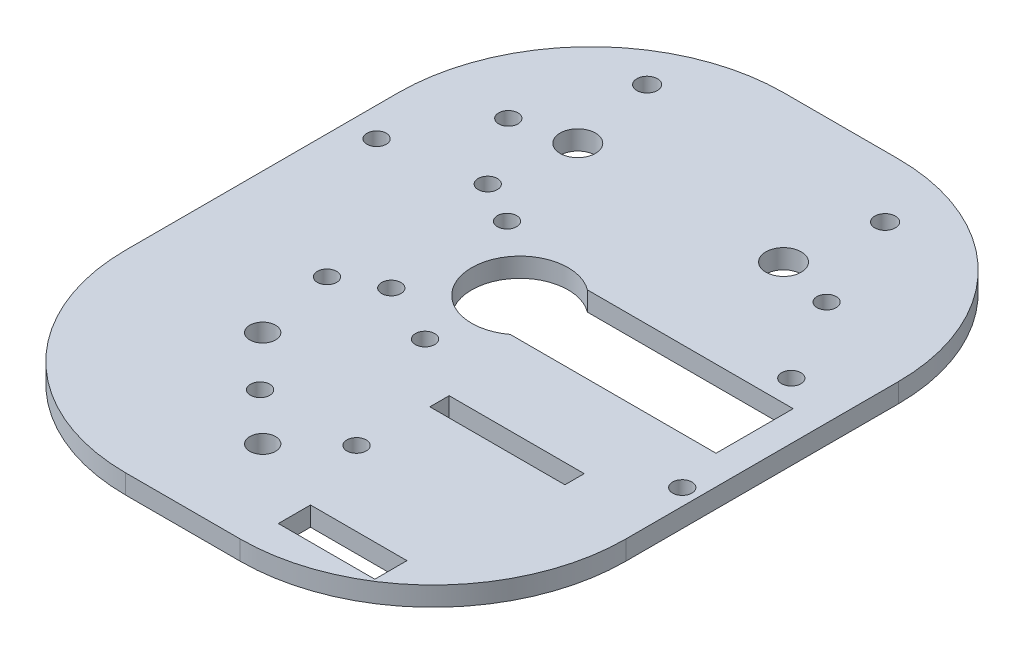
from build123d import *

# Parameters (mm, degrees)
SKETCH1_W               = 77.793311879
SKETCH1_H               = 102.364407774
SKETCH1_R               = 2.75
SKETCH1_R_2             = 2
SKETCH1_R_3             = 7.5
BOSS_EXTRUDE1_DEPTH     = 3
CUT_EXTRUDE1_DEPTH      = 69.323346558
CUT_EXTRUDE1_DEPTH_BACK = 69.323346558
SKETCH2_R               = 1.5
CUT_EXTRUDE2_DEPTH      = 69.323346558
CUT_EXTRUDE2_DEPTH_BACK = 69.323346558
SKETCH3_W               = 36
SKETCH3_H               = 12
SKETCH3_W_2             = 21
SKETCH3_H_2             = 3
SKETCH3_W_3             = 15
SKETCH3_H_3             = 5
SKETCH3_R               = 1.5
CUT_EXTRUDE3_DEPTH      = 69.323346558
CUT_EXTRUDE3_DEPTH_BACK = 69.323346558
SKETCH4_R               = 1.5
CUT_EXTRUDE4_DEPTH      = 69.323346558
CUT_EXTRUDE4_DEPTH_BACK = 69.323346558
SKETCH5_R               = 1.6
FILLET1_R               = 30
CUT_EXTRUDE5_DEPTH      = 69.323346558
CUT_EXTRUDE5_DEPTH_BACK = 69.323346558
SKETCH6_R               = 1.5


with BuildPart() as part:
    # Sketch1 → Boss-Extrude1 (new body)
    with BuildSketch(Plane(origin=(0, 0, 0), x_dir=(1, 0, 0), z_dir=(0, 1, 0))):
        with Locations((2.136088924, -3.364964086)):
            Rectangle(SKETCH1_W, SKETCH1_H)
        with Locations(Location((-16, 25, 0), (0, 0, 270))):
            Circle(SKETCH1_R, mode=Mode.SUBTRACT)
        with Locations(Location((16, 25, 0), (0, 0, 270))):
            Circle(SKETCH1_R, mode=Mode.SUBTRACT)
        with Locations(Location((-15, -25, 0), (0, 0, 270))):
            Circle(SKETCH1_R_2, mode=Mode.SUBTRACT)
        with Locations(Location((0, 0, 0), (0, 0, 270))):
            Circle(SKETCH1_R_3, mode=Mode.SUBTRACT)
        with Locations(Location((0, -40, 0), (0, 0, 270))):
            Circle(SKETCH1_R_2, mode=Mode.SUBTRACT)
    extrude(amount=BOSS_EXTRUDE1_DEPTH)

    # Sketch2 → Cut-Extrude1 (cut, two sides: drawn at the far end of the back side and taken through both)
    with BuildSketch(Plane(origin=(0, 3, 0), x_dir=(1, 0, 0), z_dir=(0, 1, 0)).offset(-CUT_EXTRUDE1_DEPTH_BACK)):
        with Locations(Location((7.5, -32.905563019, 0), (0, 0, 270))):
            Circle(SKETCH2_R)
        with Locations(Location((-7.5, -32.905563019, 0), (0, 0, 270))):
            Circle(SKETCH2_R)
        with Locations(Location((-32.2470535, 9.957590981, 0), (0, 0, 270))):
            Circle(SKETCH2_R)
        with Locations(Location((-24.7470535, 22.947972038, 0), (0, 0, 270))):
            Circle(SKETCH2_R)
        with Locations(Location((24.7470535, 22.947972038, 0), (0, 0, 270))):
            Circle(SKETCH2_R)
        with Locations(Location((32.2470535, 9.957590981, 0), (0, 0, 270))):
            Circle(SKETCH2_R)
    extrude(amount=CUT_EXTRUDE1_DEPTH + CUT_EXTRUDE1_DEPTH_BACK, mode=Mode.SUBTRACT)

    # Sketch3 → Cut-Extrude2 (cut, two sides: drawn at the far end of the back side and taken through both)
    with BuildSketch(Plane(origin=(0, 3, 0), x_dir=(1, 0, 0), z_dir=(0, 1, 0)).offset(-CUT_EXTRUDE2_DEPTH_BACK)):
        with Locations((18.5, 0)):
            Rectangle(SKETCH3_W, SKETCH3_H)
        with Locations((18.5, -20.5)):
            Rectangle(SKETCH3_W_2, SKETCH3_H_2)
        with Locations((19.434564823, -47)):
            Rectangle(SKETCH3_W_3, SKETCH3_H_3)
        with Locations(Location((38.5, -13.251338354, 0), (0, 0, 270))):
            Circle(SKETCH3_R)
        with Locations(Location((-1.5, -13.251338354, 0), (0, 0, 270))):
            Circle(SKETCH3_R)
    extrude(amount=CUT_EXTRUDE2_DEPTH + CUT_EXTRUDE2_DEPTH_BACK, mode=Mode.SUBTRACT)

    # Sketch4 → Cut-Extrude3 (cut, two sides: drawn at the far end of the back side and taken through both)
    with BuildSketch(Plane(origin=(0, 3, 0), x_dir=(1, 0, 0), z_dir=(0, 1, 0)).offset(-CUT_EXTRUDE3_DEPTH_BACK)):
        with Locations(Location((-11, 9, 0), (0, 0, 270))):
            Circle(SKETCH4_R)
        with Locations(Location((-11, -9, 0), (0, 0, 270))):
            Circle(SKETCH4_R)
    extrude(amount=CUT_EXTRUDE3_DEPTH + CUT_EXTRUDE3_DEPTH_BACK, mode=Mode.SUBTRACT)

    # Sketch5 → Cut-Extrude4 (cut, two sides: drawn at the far end of the back side and taken through both)
    with BuildSketch(Plane(origin=(0, 3, 0), x_dir=(1, 0, 0), z_dir=(0, 1, 0)).offset(-CUT_EXTRUDE4_DEPTH_BACK)):
        with Locations(Location((18.5, 38.28654225, 0), (0, 0, 270))):
            Circle(SKETCH5_R)
        with Locations(Location((-18.5, 38.28654225, 0), (0, 0, 270))):
            Circle(SKETCH5_R)
    extrude(amount=CUT_EXTRUDE4_DEPTH + CUT_EXTRUDE4_DEPTH_BACK, mode=Mode.SUBTRACT)

    # Fillet1
    fillet1_edges = [part.edges().sort_by_distance(p)[0] for p in [
        (-36.760567016, 1.5, -47.817239801),
        (41.032744863, 1.5, -47.817239801),
        (41.032744863, 1.5, 54.547167973),
        (-36.760567016, 1.5, 54.547167973),
    ]]
    fillet(fillet1_edges, radius=FILLET1_R)

    # Sketch6 → Cut-Extrude5 (cut, two sides: drawn at the far end of the back side and taken through both)
    with BuildSketch(Plane(origin=(0, 3, 0), x_dir=(1, 0, 0), z_dir=(0, 1, 0)).offset(-CUT_EXTRUDE5_DEPTH_BACK)):
        with Locations(Location((-17.49999993, 12.5, 0), (0, 0, 270))):
            Circle(SKETCH6_R)
        with Locations(Location((-17.49999993, -12.5, 0), (0, 0, 270))):
            Circle(SKETCH6_R)
    extrude(amount=CUT_EXTRUDE5_DEPTH + CUT_EXTRUDE5_DEPTH_BACK, mode=Mode.SUBTRACT)


solid = part.part
